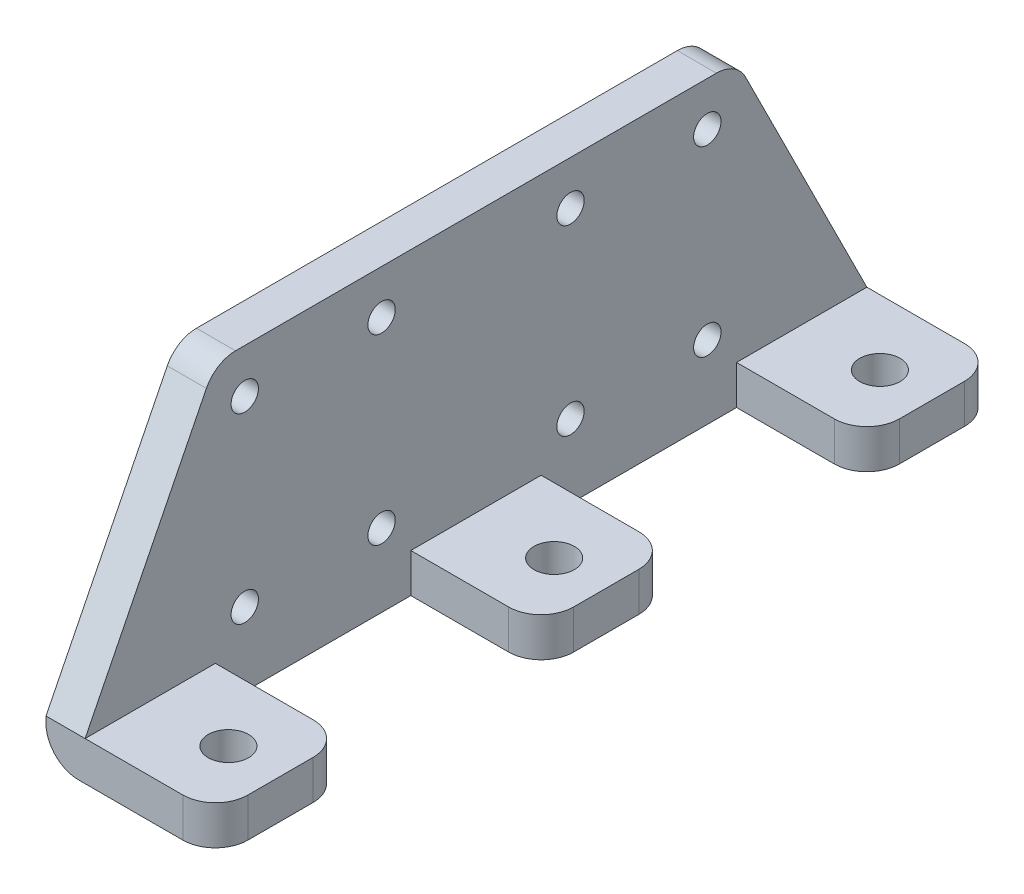
from build123d import *

# Parameters (mm, degrees)
CROQUIS2_R              = 3.1
SALIENTE_EXTRUIR1_DEPTH = 3
CROQUIS4_R              = 2.1
SALIENTE_EXTRUIR2_DEPTH = 6
REDONDEO1_R             = 5


with BuildPart() as part:
    # Croquis2 → Saliente-Extruir1 (new, symmetric)
    with BuildSketch(Plane(origin=(0, 58.707138557, 0), x_dir=(1, 0, 0), z_dir=(0, 1, 0))):
        Polygon((-236.097571291, -325), (-242.097571291, -325), (-242.097571291, -205), (-236.097571291, -205), (-216.097571291, -205), (-216.097571291, -225), (-236.097571291, -225), (-236.097571291, -255), (-216.097571291, -255), (-216.097571291, -275), (-236.097571291, -275), (-236.097571291, -305), (-216.097571291, -305), (-216.097571291, -325), align=None)
        with Locations(Location((-224.097571291, -215, 0), (0, 0, 270))):
            Circle(CROQUIS2_R, mode=Mode.SUBTRACT)
        with Locations(Location((-224.097571291, -265, 0), (0, 0, 270))):
            Circle(CROQUIS2_R, mode=Mode.SUBTRACT)
        with Locations(Location((-224.097571291, -315, 0), (0, 0, 270))):
            Circle(CROQUIS2_R, mode=Mode.SUBTRACT)
    extrude(amount=SALIENTE_EXTRUIR1_DEPTH, both=True)

    # Croquis4 → Saliente-Extruir2 (add)
    with BuildSketch(Plane.ZY.offset(242.097571291)):
        Polygon((205, 61.707138557), (325, 61.707138557), (305, 101.707138557), (225, 101.707138557), align=None)
        with Locations((250.49, 66.952138557)):
            Circle(CROQUIS4_R, mode=Mode.SUBTRACT)
        with Locations((229.49, 66.952138557)):
            Circle(CROQUIS4_R, mode=Mode.SUBTRACT)
        with Locations((279.49, 66.952138557)):
            Circle(CROQUIS4_R, mode=Mode.SUBTRACT)
        with Locations((300.49, 66.952138557)):
            Circle(CROQUIS4_R, mode=Mode.SUBTRACT)
        with Locations((279.49, 94.952138557)):
            Circle(CROQUIS4_R, mode=Mode.SUBTRACT)
        with Locations((300.49, 94.952138557)):
            Circle(CROQUIS4_R, mode=Mode.SUBTRACT)
        with Locations((229.49, 94.952138557)):
            Circle(CROQUIS4_R, mode=Mode.SUBTRACT)
        with Locations((250.49, 94.952138557)):
            Circle(CROQUIS4_R, mode=Mode.SUBTRACT)
    extrude(amount=-SALIENTE_EXTRUIR2_DEPTH)

    # Redondeo1
    redondeo1_edges = [part.edges().sort_by_distance(p)[0] for p in [
        (-242.097571291, 55.707138557, 265),
        (-216.097571291, 58.707138557, 205),
        (-216.097571291, 58.707138557, 225),
        (-216.097571291, 58.707138557, 255),
        (-216.097571291, 58.707138557, 275),
        (-216.097571291, 58.707138557, 305),
        (-216.097571291, 58.707138557, 325),
        (-239.097571291, 101.707138557, 305),
        (-239.097571291, 101.707138557, 225),
    ]]
    fillet(redondeo1_edges, radius=REDONDEO1_R)


solid = part.part
